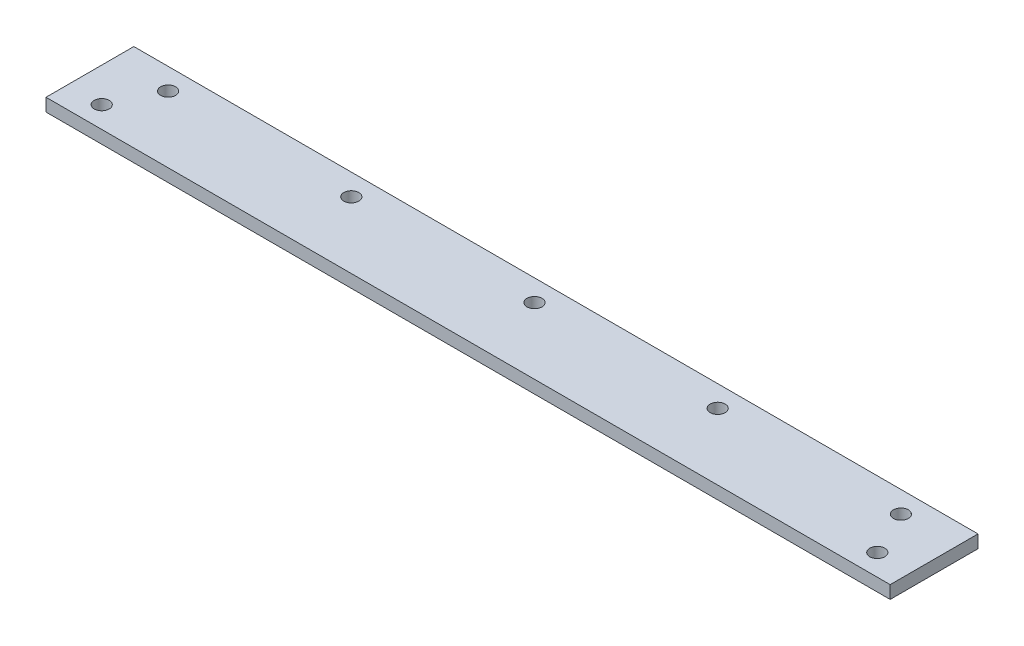
from build123d import *

# Parameters (mm, degrees)
SKETCH_1_W      = 197
SKETCH_1_H      = 20.5
EXTRUDE_1_DEPTH = 3
HOLE_WIZARD_1_D = 3.5
HOLE_WIZARD_2_D = 3.5


with BuildPart() as part:
    # 草图1 → 凸台-拉伸1 (new body)
    with BuildSketch(Plane(origin=(0, 0, 0), x_dir=(1, 0, 0), z_dir=(0, 1, 0))):
        with Locations((98.5, 10.25)):
            Rectangle(SKETCH_1_W, SKETCH_1_H)
    extrude(amount=EXTRUDE_1_DEPTH)

    # 孔1 (through all)
    with Locations(Plane(origin=(0, 3, 0), x_dir=(1, 0, 0), z_dir=(0, 1, 0))):
        with Locations((8, 5), (189, 5)):
            Hole(HOLE_WIZARD_1_D / 2)

    # 孔2 (through all)
    with Locations(Plane(origin=(0, 3, 0), x_dir=(1, 0, 0), z_dir=(0, 1, 0))):
        with Locations((98.5, 15.5), (141.25, 15.5), (55.75, 15.5), (13, 15.5), (184, 15.5)):
            Hole(HOLE_WIZARD_2_D / 2)


solid = part.part
